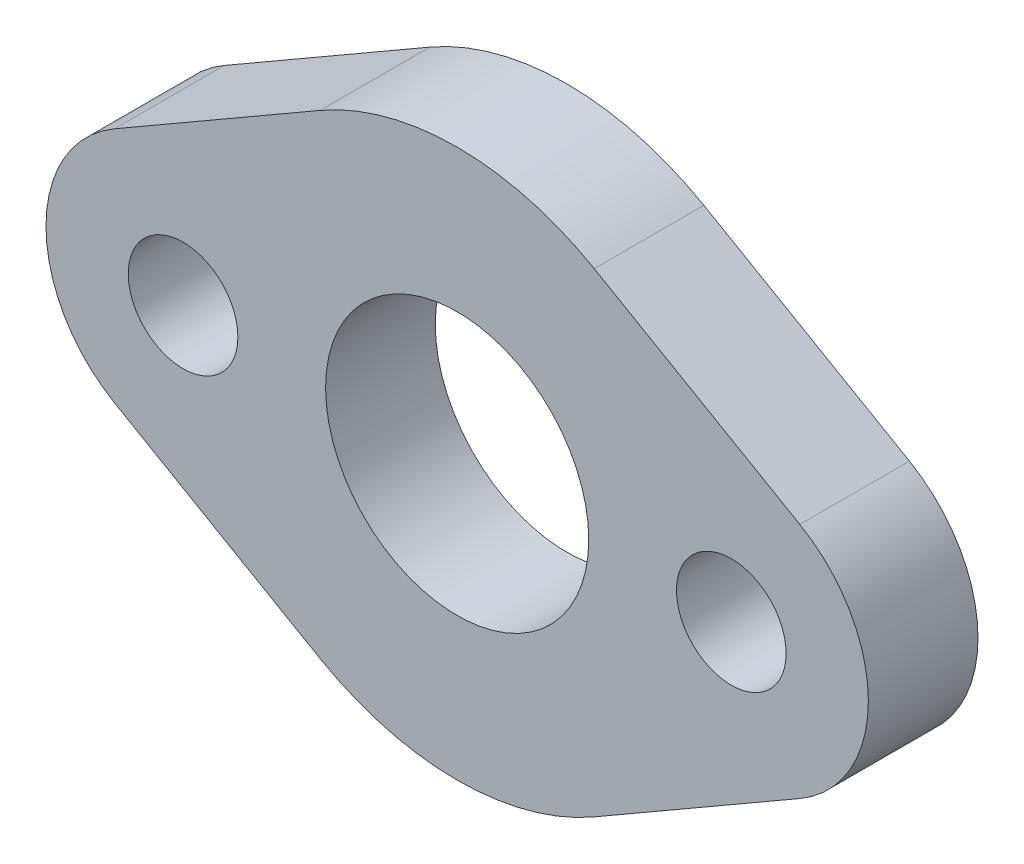
from build123d import *

# Parameters (mm, degrees)
SKETCH_1_R      = 2.4
SKETCH_1_R_2    = 1
EXTRUDE_1_DEPTH = 2


with BuildPart() as part:
    # 草图1 → 凸台-拉伸1 (new body)
    with BuildSketch(Plane.XY):
        with BuildLine():
            Line((-6.25, 2.165063509), (-2.5, 4.330127019))
            ThreePointArc((-2.5, 4.330127019), (0, 5), (2.5, 4.330127019))
            Line((2.5, 4.330127019), (6.25, 2.165063509))
            ThreePointArc((6.25, 2.165063509), (7.5, 0), (6.25, -2.165063509))
            Line((6.25, -2.165063509), (2.5, -4.330127019))
            ThreePointArc((2.5, -4.330127019), (0, -5), (-2.5, -4.330127019))
            Line((-2.5, -4.330127019), (-6.25, -2.165063509))
            ThreePointArc((-6.25, -2.165063509), (-7.5, 0), (-6.25, 2.165063509))
        make_face()
        Circle(SKETCH_1_R, mode=Mode.SUBTRACT)
        with Locations((-5, 0)):
            Circle(SKETCH_1_R_2, mode=Mode.SUBTRACT)
        with Locations((5, 0)):
            Circle(SKETCH_1_R_2, mode=Mode.SUBTRACT)
    extrude(amount=EXTRUDE_1_DEPTH)


solid = part.part
